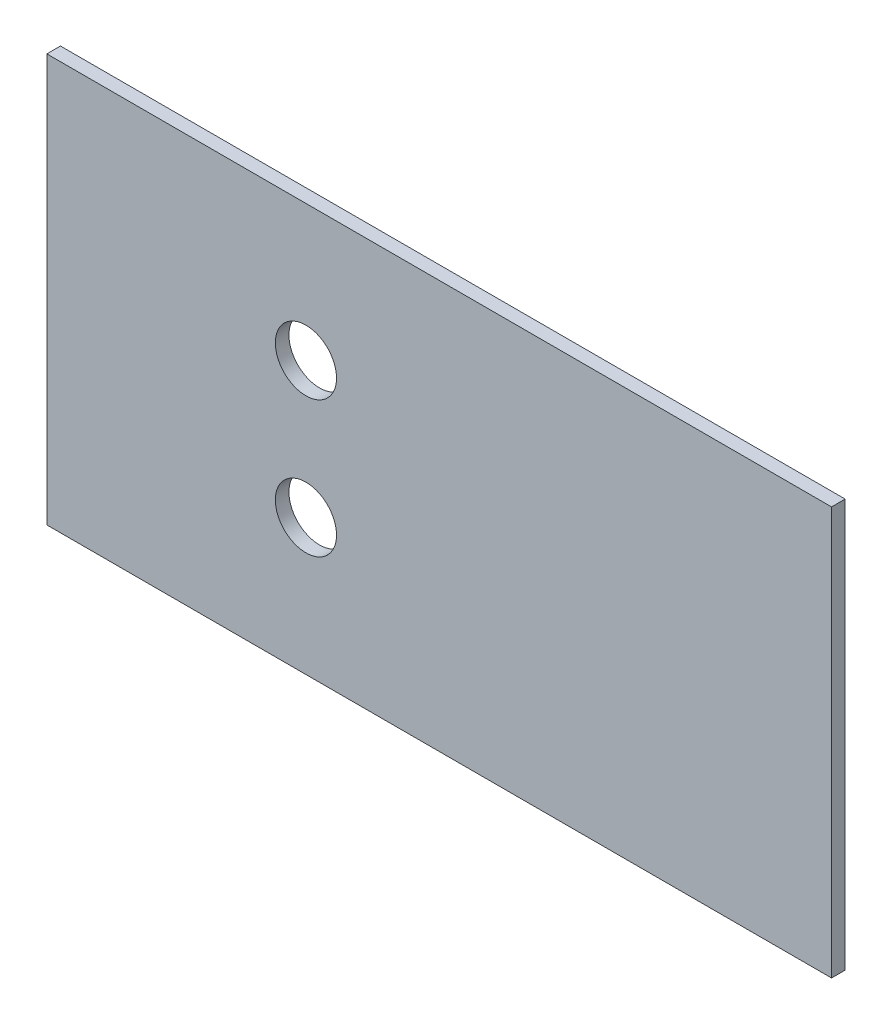
from build123d import *

# Parameters (mm, degrees)
SKETCH1_W           = 57.7
SKETCH1_H           = 30
SKETCH1_R           = 2.25
BOSS_EXTRUDE1_DEPTH = 1


with BuildPart() as part:
    # Sketch1 → Boss-Extrude1 (new body)
    with BuildSketch(Plane.XY):
        with Locations((-20.75, 22)):
            Rectangle(SKETCH1_W, SKETCH1_H)
        with Locations((-30.55, 17)):
            Circle(SKETCH1_R, mode=Mode.SUBTRACT)
        with Locations((-30.55, 27)):
            Circle(SKETCH1_R, mode=Mode.SUBTRACT)
    extrude(amount=BOSS_EXTRUDE1_DEPTH)


solid = part.part
